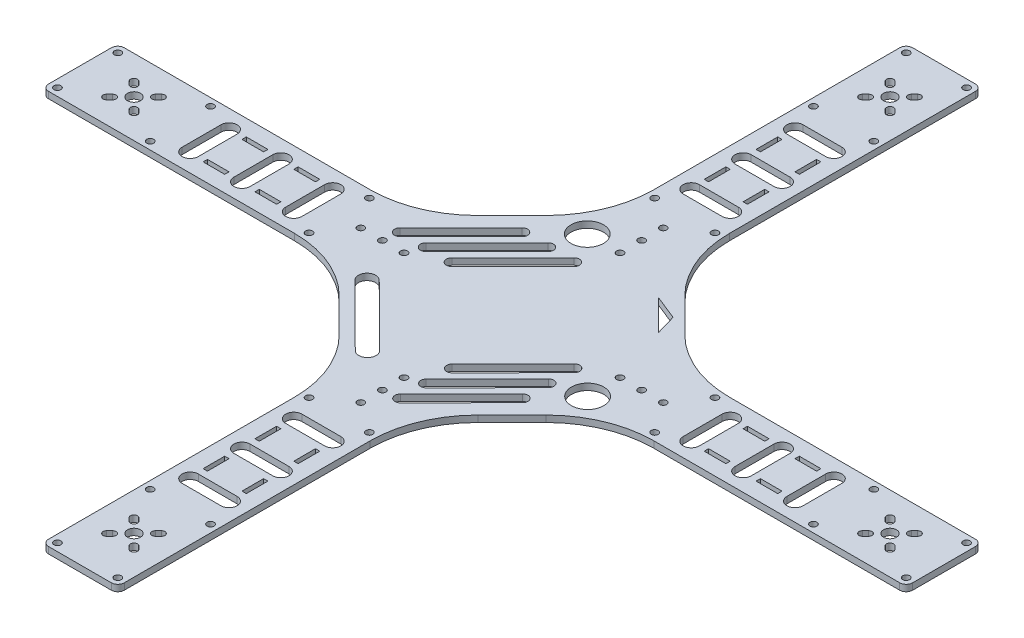
from build123d import *

# Parameters (mm, degrees)
SKETCH_203_R        = 1.6
SKETCH_203_W        = 10
SKETCH_203_H        = 2
SKETCH_203_R_2      = 3
SKETCH_203_W_2      = 2
SKETCH_203_H_2      = 10
EXTRUDE_1_DEPTH     = 3
FILLET_3_R          = 3
SKETCH_1_R          = 1.6
SKETCH_1_R_2        = 7.5
CUT_EXTRUDE_1_DEPTH = 10


with BuildPart() as part:
    # Sketch 203 → 凸台-拉伸1 (new body)
    with BuildSketch(Plane(origin=(0, 0, 0), x_dir=(1, 0, 0), z_dir=(0, 1, 0))):
        with BuildLine():
            Line((17.5, 25), (-17.5, 25))
            Line((-17.5, 25), (-17.5, -91.789321881))
            ThreePointArc((-17.5, -91.789321881), (-21.306023374, -110.9234935), (-32.144660941, -127.144660941))
            Line((-32.144660941, -127.144660941), (-47.855339059, -142.855339059))
            ThreePointArc((-47.855339059, -142.855339059), (-64.0765065, -153.693976626), (-83.210678119, -157.5))
            Line((-83.210678119, -157.5), (-200, -157.5))
            Line((-200, -157.5), (-200, -192.5))
            Line((-200, -192.5), (-83.210678119, -192.5))
            ThreePointArc((-83.210678119, -192.5), (-64.0765065, -196.306023374), (-47.855339059, -207.144660941))
            Line((-47.855339059, -207.144660941), (-32.144660941, -222.855339059))
            ThreePointArc((-32.144660941, -222.855339059), (-21.306023374, -239.0765065), (-17.5, -258.210678119))
            Line((-17.5, -258.210678119), (-17.5, -375))
            Line((-17.5, -375), (17.5, -375))
            Line((17.5, -375), (17.5, -258.210678119))
            ThreePointArc((17.5, -258.210678119), (21.306023374, -239.0765065), (32.144660941, -222.855339059))
            Line((32.144660941, -222.855339059), (47.855339059, -207.144660941))
            ThreePointArc((47.855339059, -207.144660941), (64.0765065, -196.306023374), (83.210678119, -192.5))
            Line((83.210678119, -192.5), (200, -192.5))
            Line((200, -192.5), (200, -157.5))
            Line((200, -157.5), (83.210678119, -157.5))
            ThreePointArc((83.210678119, -157.5), (64.0765065, -153.693976626), (47.855339059, -142.855339059))
            Line((47.855339059, -142.855339059), (32.144660941, -127.144660941))
            ThreePointArc((32.144660941, -127.144660941), (21.306023374, -110.9234935), (17.5, -91.789321881))
            Line((17.5, -91.789321881), (17.5, 25))
        make_face()
        with Locations(Location((-196.464466094, -188.964466094, 0), (0, 0, 270))):
            Circle(SKETCH_203_R, mode=Mode.SUBTRACT)
        with BuildLine():
            ThreePointArc((-181.081118318, -178.818376618), (-178.818376618, -178.818376618), (-178.818376618, -181.081118318))
            Line((-178.818376618, -181.081118318), (-180.232590181, -182.495331881))
            ThreePointArc((-180.232590181, -182.495331881), (-182.495331881, -182.495331881), (-182.495331881, -180.232590181))
            Line((-182.495331881, -180.232590181), (-181.081118318, -178.818376618))
        make_face(mode=Mode.SUBTRACT)
        with Locations(Location((-153.535533906, -188.964466094, 0), (0, 0, 270))):
            Circle(SKETCH_203_R, mode=Mode.SUBTRACT)
        with BuildLine():
            ThreePointArc((-171.181623382, -181.081118318), (-171.181623382, -178.818376618), (-168.918881682, -178.818376618))
            Line((-168.918881682, -178.818376618), (-167.504668119, -180.232590181))
            ThreePointArc((-167.504668119, -180.232590181), (-167.504668119, -182.495331881), (-169.767409819, -182.495331881))
            Line((-169.767409819, -182.495331881), (-171.181623382, -181.081118318))
        make_face(mode=Mode.SUBTRACT)
        with Locations((-128, -184)):
            Rectangle(SKETCH_203_W, SKETCH_203_H, mode=Mode.SUBTRACT)
        with Locations((-104, -184)):
            Rectangle(SKETCH_203_W, SKETCH_203_H, mode=Mode.SUBTRACT)
        with Locations(Location((-80, -188.964466094, 0), (0, 0, 270))):
            Circle(SKETCH_203_R, mode=Mode.SUBTRACT)
        with Locations(Location((-175, -175, 0), (0, 0, 270))):
            Circle(SKETCH_203_R_2, mode=Mode.SUBTRACT)
        with BuildLine():
            ThreePointArc((-178.818376618, -168.918881682), (-178.818376618, -171.181623382), (-181.081118318, -171.181623382))
            Line((-181.081118318, -171.181623382), (-182.495331881, -169.767409819))
            ThreePointArc((-182.495331881, -169.767409819), (-182.495331881, -167.504668119), (-180.232590181, -167.504668119))
            Line((-180.232590181, -167.504668119), (-178.818376618, -168.918881682))
        make_face(mode=Mode.SUBTRACT)
        with BuildLine():
            ThreePointArc((-168.918881682, -171.181623382), (-171.181623382, -171.181623382), (-171.181623382, -168.918881682))
            Line((-171.181623382, -168.918881682), (-169.767409819, -167.504668119))
            ThreePointArc((-169.767409819, -167.504668119), (-167.504668119, -167.504668119), (-167.504668119, -169.767409819))
            Line((-167.504668119, -169.767409819), (-168.918881682, -171.181623382))
        make_face(mode=Mode.SUBTRACT)
        with Locations(Location((-196.464466094, -161.035533906, 0), (0, 0, 270))):
            Circle(SKETCH_203_R, mode=Mode.SUBTRACT)
        with Locations(Location((-153.535533906, -161.035533906, 0), (0, 0, 270))):
            Circle(SKETCH_203_R, mode=Mode.SUBTRACT)
        with BuildLine():
            ThreePointArc((-143.75, -166), (-140, -162.25), (-136.25, -166))
            Line((-136.25, -166), (-136.25, -184))
            ThreePointArc((-136.25, -184), (-140, -187.75), (-143.75, -184))
            Line((-143.75, -184), (-143.75, -175))
            Line((-143.75, -175), (-143.75, -166))
        make_face(mode=Mode.SUBTRACT)
        Polygon((-133, -167), (-133, -166), (-133, -165), (-123, -165), (-123, -166), (-123, -167), align=None, mode=Mode.SUBTRACT)
        with BuildLine():
            Line((-119.75, -184), (-119.75, -166))
            ThreePointArc((-119.75, -166), (-116, -162.25), (-112.25, -166))
            Line((-112.25, -166), (-112.25, -184))
            ThreePointArc((-112.25, -184), (-116, -187.75), (-119.75, -184))
        make_face(mode=Mode.SUBTRACT)
        with Locations((-104, -166)):
            Rectangle(SKETCH_203_W, SKETCH_203_H, mode=Mode.SUBTRACT)
        with BuildLine():
            ThreePointArc((-88.25, -184), (-92, -187.75), (-95.75, -184))
            Line((-95.75, -184), (-95.75, -166))
            ThreePointArc((-95.75, -166), (-92, -162.25), (-88.25, -166))
            Line((-88.25, -166), (-88.25, -184))
        make_face(mode=Mode.SUBTRACT)
        with Locations(Location((-70, -175, 0), (0, 0, 270))):
            Circle(SKETCH_203_R, mode=Mode.SUBTRACT)
        with Locations(Location((-80, -161.035533906, 0), (0, 0, 270))):
            Circle(SKETCH_203_R, mode=Mode.SUBTRACT)
        with Locations(Location((0, -245, 0), (0, 0, 270))):
            Circle(SKETCH_203_R, mode=Mode.SUBTRACT)
        with Locations(Location((80, -188.964466094, 0), (0, 0, 270))):
            Circle(SKETCH_203_R, mode=Mode.SUBTRACT)
        with Locations((104, -184)):
            Rectangle(SKETCH_203_W, SKETCH_203_H, mode=Mode.SUBTRACT)
        Polygon((123, -183), (133, -183), (133, -184), (133, -185), (123, -185), (123, -184), align=None, mode=Mode.SUBTRACT)
        with Locations(Location((153.535533906, -188.964466094, 0), (0, 0, 270))):
            Circle(SKETCH_203_R, mode=Mode.SUBTRACT)
        with BuildLine():
            ThreePointArc((168.918881682, -178.818376618), (171.181623382, -178.818376618), (171.181623382, -181.081118318))
            Line((171.181623382, -181.081118318), (169.767409819, -182.495331881))
            ThreePointArc((169.767409819, -182.495331881), (167.504668119, -182.495331881), (167.504668119, -180.232590181))
            Line((167.504668119, -180.232590181), (168.918881682, -178.818376618))
        make_face(mode=Mode.SUBTRACT)
        with Locations(Location((196.464466094, -188.964466094, 0), (0, 0, 270))):
            Circle(SKETCH_203_R, mode=Mode.SUBTRACT)
        with BuildLine():
            ThreePointArc((178.818376618, -181.081118318), (178.818376618, -178.818376618), (181.081118318, -178.818376618))
            Line((181.081118318, -178.818376618), (182.495331881, -180.232590181))
            ThreePointArc((182.495331881, -180.232590181), (182.495331881, -182.495331881), (180.232590181, -182.495331881))
            Line((180.232590181, -182.495331881), (178.818376618, -181.081118318))
        make_face(mode=Mode.SUBTRACT)
        with Locations(Location((70, -175, 0), (0, 0, 270))):
            Circle(SKETCH_203_R, mode=Mode.SUBTRACT)
        with BuildLine():
            ThreePointArc((88.25, -166), (92, -162.25), (95.75, -166))
            Line((95.75, -166), (95.75, -184))
            ThreePointArc((95.75, -184), (92, -187.75), (88.25, -184))
            Line((88.25, -184), (88.25, -166))
        make_face(mode=Mode.SUBTRACT)
        with Locations(Location((80, -161.035533906, 0), (0, 0, 270))):
            Circle(SKETCH_203_R, mode=Mode.SUBTRACT)
        with BuildLine():
            Line((119.75, -166), (119.75, -184))
            ThreePointArc((119.75, -184), (116, -187.75), (112.25, -184))
            Line((112.25, -184), (112.25, -166))
            ThreePointArc((112.25, -166), (116, -162.25), (119.75, -166))
        make_face(mode=Mode.SUBTRACT)
        with Locations((104, -166)):
            Rectangle(SKETCH_203_W, SKETCH_203_H, mode=Mode.SUBTRACT)
        with BuildLine():
            ThreePointArc((143.75, -184), (140, -187.75), (136.25, -184))
            Line((136.25, -184), (136.25, -166))
            ThreePointArc((136.25, -166), (140, -162.25), (143.75, -166))
            Line((143.75, -166), (143.75, -175))
            Line((143.75, -175), (143.75, -184))
        make_face(mode=Mode.SUBTRACT)
        with Locations((128, -166)):
            Rectangle(SKETCH_203_W, SKETCH_203_H, mode=Mode.SUBTRACT)
        with BuildLine():
            ThreePointArc((171.181623382, -168.918881682), (171.181623382, -171.181623382), (168.918881682, -171.181623382))
            Line((168.918881682, -171.181623382), (167.504668119, -169.767409819))
            ThreePointArc((167.504668119, -169.767409819), (167.504668119, -167.504668119), (169.767409819, -167.504668119))
            Line((169.767409819, -167.504668119), (171.181623382, -168.918881682))
        make_face(mode=Mode.SUBTRACT)
        with Locations(Location((175, -175, 0), (0, 0, 270))):
            Circle(SKETCH_203_R_2, mode=Mode.SUBTRACT)
        with BuildLine():
            ThreePointArc((181.081118318, -171.181623382), (178.818376618, -171.181623382), (178.818376618, -168.918881682))
            Line((178.818376618, -168.918881682), (180.232590181, -167.504668119))
            ThreePointArc((180.232590181, -167.504668119), (182.495331881, -167.504668119), (182.495331881, -169.767409819))
            Line((182.495331881, -169.767409819), (181.081118318, -171.181623382))
        make_face(mode=Mode.SUBTRACT)
        with Locations(Location((153.535533906, -161.035533906, 0), (0, 0, 270))):
            Circle(SKETCH_203_R, mode=Mode.SUBTRACT)
        with Locations(Location((196.464466094, -161.035533906, 0), (0, 0, 270))):
            Circle(SKETCH_203_R, mode=Mode.SUBTRACT)
        with Locations(Location((0, -105, 0), (0, 0, 270))):
            Circle(SKETCH_203_R, mode=Mode.SUBTRACT)
        with Locations(Location((-13.964466094, -95, 0), (0, 0, 270))):
            Circle(SKETCH_203_R, mode=Mode.SUBTRACT)
        with BuildLine():
            ThreePointArc((-9, -86.75), (-12.75, -83), (-9, -79.25))
            Line((-9, -79.25), (9, -79.25))
            ThreePointArc((9, -79.25), (12.75, -83), (9, -86.75))
            Line((9, -86.75), (-9, -86.75))
        make_face(mode=Mode.SUBTRACT)
        with Locations((-9, -71)):
            Rectangle(SKETCH_203_W_2, SKETCH_203_H_2, mode=Mode.SUBTRACT)
        with BuildLine():
            ThreePointArc((-9, -62.75), (-12.75, -59), (-9, -55.25))
            Line((-9, -55.25), (9, -55.25))
            ThreePointArc((9, -55.25), (12.75, -59), (9, -62.75))
            Line((9, -62.75), (-9, -62.75))
        make_face(mode=Mode.SUBTRACT)
        with Locations((-9, -47)):
            Rectangle(SKETCH_203_W_2, SKETCH_203_H_2, mode=Mode.SUBTRACT)
        with BuildLine():
            ThreePointArc((9, -31.25), (12.75, -35), (9, -38.75))
            Line((9, -38.75), (-9, -38.75))
            ThreePointArc((-9, -38.75), (-12.75, -35), (-9, -31.25))
            Line((-9, -31.25), (0, -31.25))
            Line((0, -31.25), (9, -31.25))
        make_face(mode=Mode.SUBTRACT)
        with Locations(Location((-13.964466094, -21.464466094, 0), (0, 0, 270))):
            Circle(SKETCH_203_R, mode=Mode.SUBTRACT)
        with BuildLine():
            ThreePointArc((-6.081118318, -3.818376618), (-3.818376618, -3.818376618), (-3.818376618, -6.081118318))
            Line((-3.818376618, -6.081118318), (-5.232590181, -7.495331881))
            ThreePointArc((-5.232590181, -7.495331881), (-7.495331881, -7.495331881), (-7.495331881, -5.232590181))
            Line((-7.495331881, -5.232590181), (-6.081118318, -3.818376618))
        make_face(mode=Mode.SUBTRACT)
        with Locations(Location((0, 0, 0), (0, 0, 270))):
            Circle(SKETCH_203_R_2, mode=Mode.SUBTRACT)
        with BuildLine():
            ThreePointArc((-3.818376618, 6.081118318), (-3.818376618, 3.818376618), (-6.081118318, 3.818376618))
            Line((-6.081118318, 3.818376618), (-7.495331881, 5.232590181))
            ThreePointArc((-7.495331881, 5.232590181), (-7.495331881, 7.495331881), (-5.232590181, 7.495331881))
            Line((-5.232590181, 7.495331881), (-3.818376618, 6.081118318))
        make_face(mode=Mode.SUBTRACT)
        with Locations(Location((-13.964466094, 21.464466094, 0), (0, 0, 270))):
            Circle(SKETCH_203_R, mode=Mode.SUBTRACT)
        with Locations(Location((13.964466094, -95, 0), (0, 0, 270))):
            Circle(SKETCH_203_R, mode=Mode.SUBTRACT)
        with Locations((9, -71)):
            Rectangle(SKETCH_203_W_2, SKETCH_203_H_2, mode=Mode.SUBTRACT)
        Polygon((10, -52), (9, -52), (8, -52), (8, -42), (9, -42), (10, -42), align=None, mode=Mode.SUBTRACT)
        with Locations(Location((13.964466094, -21.464466094, 0), (0, 0, 270))):
            Circle(SKETCH_203_R, mode=Mode.SUBTRACT)
        with BuildLine():
            ThreePointArc((3.818376618, -6.081118318), (3.818376618, -3.818376618), (6.081118318, -3.818376618))
            Line((6.081118318, -3.818376618), (7.495331881, -5.232590181))
            ThreePointArc((7.495331881, -5.232590181), (7.495331881, -7.495331881), (5.232590181, -7.495331881))
            Line((5.232590181, -7.495331881), (3.818376618, -6.081118318))
        make_face(mode=Mode.SUBTRACT)
        with BuildLine():
            ThreePointArc((6.081118318, 3.818376618), (3.818376618, 3.818376618), (3.818376618, 6.081118318))
            Line((3.818376618, 6.081118318), (5.232590181, 7.495331881))
            ThreePointArc((5.232590181, 7.495331881), (7.495331881, 7.495331881), (7.495331881, 5.232590181))
            Line((7.495331881, 5.232590181), (6.081118318, 3.818376618))
        make_face(mode=Mode.SUBTRACT)
        with Locations(Location((13.964466094, 21.464466094, 0), (0, 0, 270))):
            Circle(SKETCH_203_R, mode=Mode.SUBTRACT)
        with Locations(Location((-13.964466094, -371.464466094, 0), (0, 0, 270))):
            Circle(SKETCH_203_R, mode=Mode.SUBTRACT)
        with BuildLine():
            ThreePointArc((-6.081118318, -353.818376618), (-3.818376618, -353.818376618), (-3.818376618, -356.081118318))
            Line((-3.818376618, -356.081118318), (-5.232590181, -357.495331881))
            ThreePointArc((-5.232590181, -357.495331881), (-7.495331881, -357.495331881), (-7.495331881, -355.232590181))
            Line((-7.495331881, -355.232590181), (-6.081118318, -353.818376618))
        make_face(mode=Mode.SUBTRACT)
        with BuildLine():
            ThreePointArc((-3.818376618, -343.918881682), (-3.818376618, -346.181623382), (-6.081118318, -346.181623382))
            Line((-6.081118318, -346.181623382), (-7.495331881, -344.767409819))
            ThreePointArc((-7.495331881, -344.767409819), (-7.495331881, -342.504668119), (-5.232590181, -342.504668119))
            Line((-5.232590181, -342.504668119), (-3.818376618, -343.918881682))
        make_face(mode=Mode.SUBTRACT)
        with Locations(Location((0, -350, 0), (0, 0, 270))):
            Circle(SKETCH_203_R_2, mode=Mode.SUBTRACT)
        with Locations(Location((-13.964466094, -328.535533906, 0), (0, 0, 270))):
            Circle(SKETCH_203_R, mode=Mode.SUBTRACT)
        with BuildLine():
            ThreePointArc((3.818376618, -356.081118318), (3.818376618, -353.818376618), (6.081118318, -353.818376618))
            Line((6.081118318, -353.818376618), (7.495331881, -355.232590181))
            ThreePointArc((7.495331881, -355.232590181), (7.495331881, -357.495331881), (5.232590181, -357.495331881))
            Line((5.232590181, -357.495331881), (3.818376618, -356.081118318))
        make_face(mode=Mode.SUBTRACT)
        with BuildLine():
            ThreePointArc((6.081118318, -346.181623382), (3.818376618, -346.181623382), (3.818376618, -343.918881682))
            Line((3.818376618, -343.918881682), (5.232590181, -342.504668119))
            ThreePointArc((5.232590181, -342.504668119), (7.495331881, -342.504668119), (7.495331881, -344.767409819))
            Line((7.495331881, -344.767409819), (6.081118318, -346.181623382))
        make_face(mode=Mode.SUBTRACT)
        with Locations(Location((13.964466094, -371.464466094, 0), (0, 0, 270))):
            Circle(SKETCH_203_R, mode=Mode.SUBTRACT)
        with BuildLine():
            ThreePointArc((-9, -318.75), (-12.75, -315), (-9, -311.25))
            Line((-9, -311.25), (9, -311.25))
            ThreePointArc((9, -311.25), (12.75, -315), (9, -318.75))
            Line((9, -318.75), (0, -318.75))
            Line((0, -318.75), (-9, -318.75))
        make_face(mode=Mode.SUBTRACT)
        with Locations(Location((13.964466094, -328.535533906, 0), (0, 0, 270))):
            Circle(SKETCH_203_R, mode=Mode.SUBTRACT)
        Polygon((-8, -308), (-9, -308), (-10, -308), (-10, -298), (-9, -298), (-8, -298), align=None, mode=Mode.SUBTRACT)
        with Locations((-9, -279)):
            Rectangle(SKETCH_203_W_2, SKETCH_203_H_2, mode=Mode.SUBTRACT)
        with Locations(Location((-13.964466094, -255, 0), (0, 0, 270))):
            Circle(SKETCH_203_R, mode=Mode.SUBTRACT)
        with BuildLine():
            Line((9, -294.75), (-9, -294.75))
            ThreePointArc((-9, -294.75), (-12.75, -291), (-9, -287.25))
            Line((-9, -287.25), (9, -287.25))
            ThreePointArc((9, -287.25), (12.75, -291), (9, -294.75))
        make_face(mode=Mode.SUBTRACT)
        with Locations((9, -303)):
            Rectangle(SKETCH_203_W_2, SKETCH_203_H_2, mode=Mode.SUBTRACT)
        with BuildLine():
            ThreePointArc((9, -263.25), (12.75, -267), (9, -270.75))
            Line((9, -270.75), (-9, -270.75))
            ThreePointArc((-9, -270.75), (-12.75, -267), (-9, -263.25))
            Line((-9, -263.25), (9, -263.25))
        make_face(mode=Mode.SUBTRACT)
        with Locations((9, -279)):
            Rectangle(SKETCH_203_W_2, SKETCH_203_H_2, mode=Mode.SUBTRACT)
        with Locations(Location((13.964466094, -255, 0), (0, 0, 270))):
            Circle(SKETCH_203_R, mode=Mode.SUBTRACT)
    extrude(amount=EXTRUDE_1_DEPTH)

    # 圆角3
    fillet_3_edges = [part.edges().sort_by_distance(p)[0] for p in [
        (-200, 1.5, 192.5),
        (-200, 1.5, 157.5),
        (-17.5, 1.5, -25),
        (17.5, 1.5, -25),
        (200, 1.5, 157.5),
        (200, 1.5, 192.5),
        (17.5, 1.5, 375),
        (-17.5, 1.5, 375),
    ]]
    fillet(fillet_3_edges, radius=FILLET_3_R)

    # 草图1 → 切除-拉伸1 (cut)
    with BuildSketch(Plane(origin=(0, 3, 0), x_dir=(1, 0, 0), z_dir=(0, 1, 0))):
        Polygon((38.111486003, -138.544274329), (26.703267833, -133.96551115), (40.888659358, -148.150902674), align=None)
        with BuildLine():
            Line((-16.490532209, -219.752896089), (-44.800213473, -191.66164915))
            ThreePointArc((-44.800213473, -191.66164915), (-50.457025298, -191.683557333), (-50.435117115, -197.340369159))
            Line((-50.435117115, -197.340369159), (-22.125435851, -225.431616098))
            ThreePointArc((-22.125435851, -225.431616098), (-16.468624025, -225.409707915), (-16.490532209, -219.752896089))
        make_face()
        with BuildLine():
            Line((-8.702370371, -137.594600101), (-36.986641619, -165.878871349))
            ThreePointArc((-36.986641619, -165.878871349), (-36.986641619, -169.414405255), (-33.451107713, -169.414405255))
            Line((-33.451107713, -169.414405255), (-19.308972089, -155.272269631))
            Line((-19.308972089, -155.272269631), (-5.166836465, -141.130134007))
            ThreePointArc((-5.166836465, -141.130134007), (-5.166836465, -137.594600101), (-8.702370371, -137.594600101))
        make_face()
        with BuildLine():
            Line((-20.702370371, -137.594600101), (-48.986641619, -165.878871349))
            ThreePointArc((-48.986641619, -165.878871349), (-48.986641619, -169.414405255), (-45.451107713, -169.414405255))
            Line((-45.451107713, -169.414405255), (-17.166836465, -141.130134007))
            ThreePointArc((-17.166836465, -141.130134007), (-17.166836465, -137.594600101), (-20.702370371, -137.594600101))
        make_face()
        with BuildLine():
            Line((-32.702370371, -137.594600101), (-60.986641619, -165.878871349))
            ThreePointArc((-60.986641619, -165.878871349), (-60.986641619, -169.414405255), (-57.451107713, -169.414405255))
            Line((-57.451107713, -169.414405255), (-29.166836465, -141.130134007))
            ThreePointArc((-29.166836465, -141.130134007), (-29.166836465, -137.594600101), (-32.702370371, -137.594600101))
        make_face()
        with BuildLine():
            ThreePointArc((5.669250976, -208.437031406), (5.678094666, -211.972554251), (9.213617511, -211.963710561))
            Line((9.213617511, -211.963710561), (37.427050754, -183.608778281))
            ThreePointArc((37.427050754, -183.608778281), (37.418207064, -180.073255435), (33.882684219, -180.082099125))
            Line((33.882684219, -180.082099125), (5.669250976, -208.437031406))
        make_face()
        with BuildLine():
            ThreePointArc((5.729283933, -232.436956323), (5.738127623, -235.972479169), (9.273650468, -235.963635479))
            Line((9.273650468, -235.963635479), (37.487083712, -207.608703198))
            ThreePointArc((37.487083712, -207.608703198), (37.478240022, -204.073180353), (33.942717177, -204.082024043))
            Line((33.942717177, -204.082024043), (5.729283933, -232.436956323))
        make_face()
        with BuildLine():
            ThreePointArc((5.699267455, -220.436993865), (5.708111145, -223.97251671), (9.24363399, -223.96367302))
            Line((9.24363399, -223.96367302), (37.457067233, -195.608740739))
            ThreePointArc((37.457067233, -195.608740739), (37.448223543, -192.073217894), (33.912700698, -192.082061584))
            Line((33.912700698, -192.082061584), (5.699267455, -220.436993865))
        make_face()
        with Locations(Location((0, -115, 0), (0, 0, 270))):
            Circle(SKETCH_1_R)
        with Locations(Location((0, -125, 0), (0, 0, 270))):
            Circle(SKETCH_1_R)
        with Locations(Location((60, -175, 0), (0, 0, 270))):
            Circle(SKETCH_1_R)
        with Locations(Location((50, -175, 0), (0, 0, 270))):
            Circle(SKETCH_1_R)
        with Locations(Location((0, -235, 0), (0, 0, 270))):
            Circle(SKETCH_1_R)
        with Locations(Location((0, -225, 0), (0, 0, 270))):
            Circle(SKETCH_1_R)
        with Locations(Location((-60, -175, 0), (0, 0, 270))):
            Circle(SKETCH_1_R)
        with Locations(Location((-50, -175, 0), (0, 0, 270))):
            Circle(SKETCH_1_R)
        with Locations(Location((50, -190, 0), (0, 0, 270))):
            Circle(SKETCH_1_R_2)
        with Locations(Location((-15.125021735, -125.03767702, 0), (0, 0, 270))):
            Circle(SKETCH_1_R_2)
    extrude(amount=-CUT_EXTRUDE_1_DEPTH, mode=Mode.SUBTRACT)


solid = part.part
